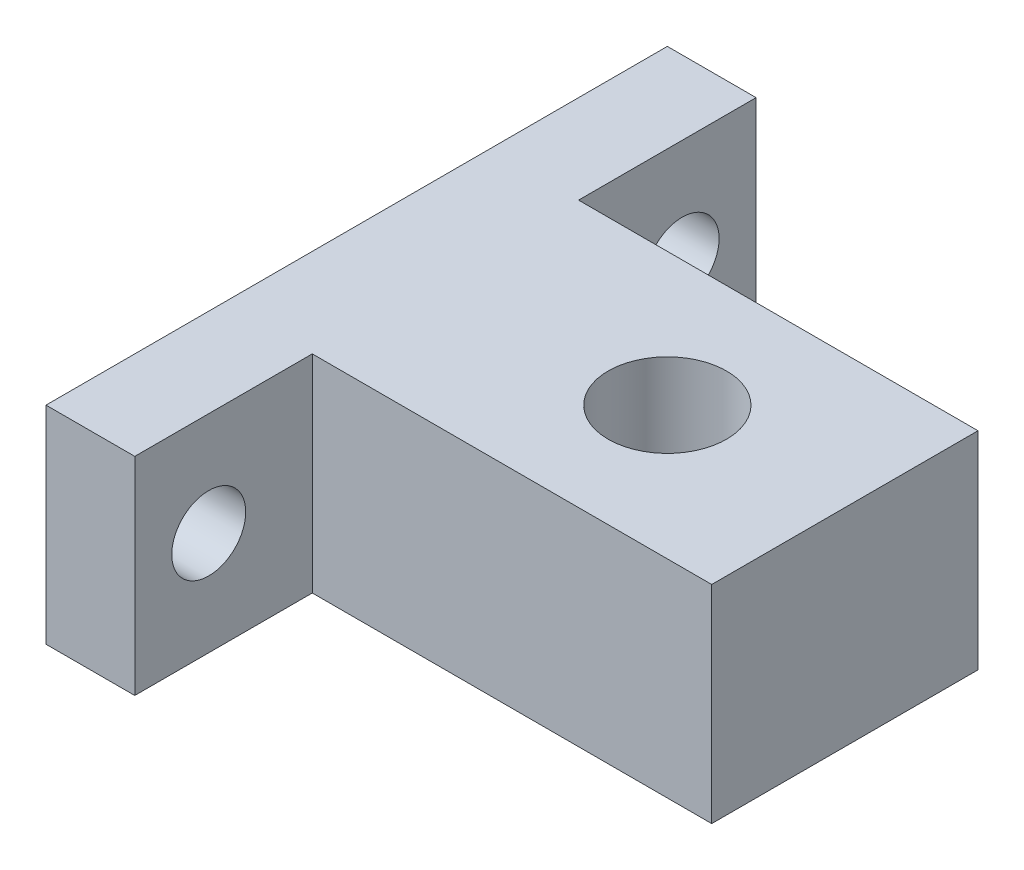
from build123d import *

# Parameters (mm, degrees)
SKETCH_1_R          = 4
EXTRUDE_1_DEPTH     = 14
SKETCH_2_R          = 2.5
CUT_EXTRUDE_1_DEPTH = 10


with BuildPart() as part:
    # 草图1 → 凸台-拉伸1 (new body)
    with BuildSketch(Plane(origin=(0, 0, 0), x_dir=(1, 0, 0), z_dir=(0, 1, 0))):
        Polygon((3, -21), (3, -9), (30, -9), (30, 9), (3, 9), (3, 21), (-3, 21), (-3, -21), align=None)
        with Locations(Location((18, 0, 0), (0, 0, 270))):
            Circle(SKETCH_1_R, mode=Mode.SUBTRACT)
    extrude(amount=EXTRUDE_1_DEPTH)

    # 草图2 → 切除-拉伸1 (cut)
    with BuildSketch(Plane(origin=(3, 0, 0), x_dir=(0, 0, -1), z_dir=(1, 0, 0))):
        with Locations((-16, 7)):
            Circle(SKETCH_2_R)
        with Locations((16, 7)):
            Circle(SKETCH_2_R)
    extrude(amount=-CUT_EXTRUDE_1_DEPTH, mode=Mode.SUBTRACT)


solid = part.part
